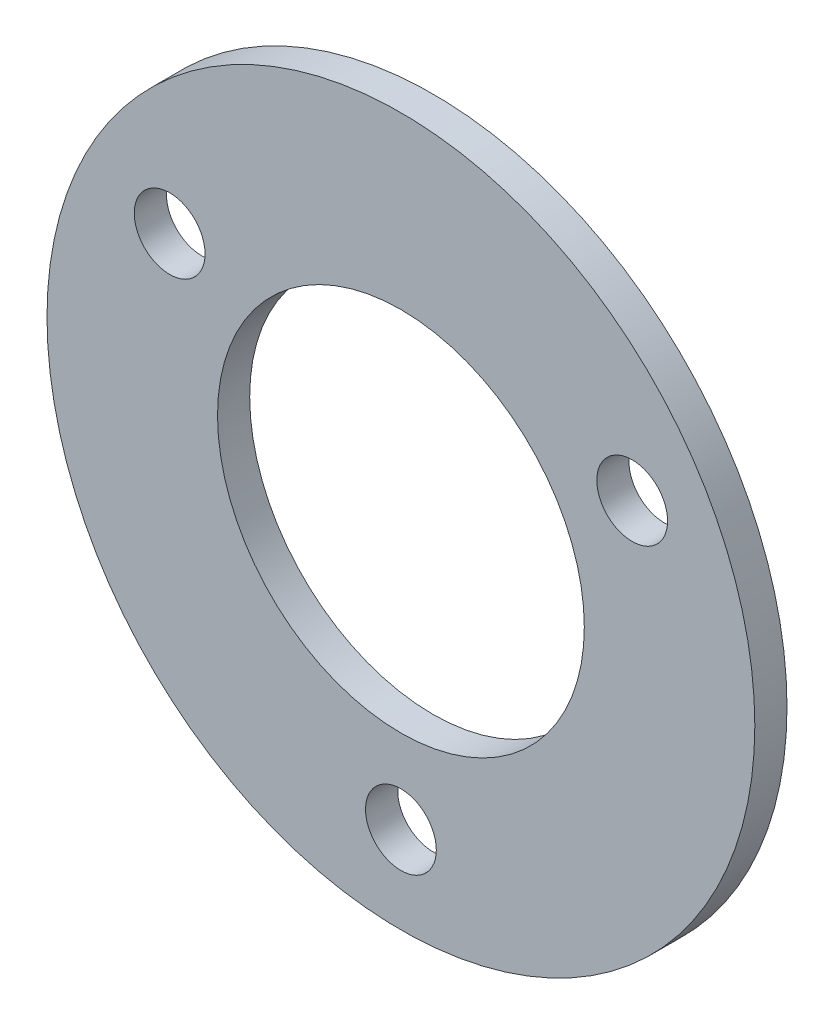
from build123d import *

# Parameters (mm, degrees)
SKETCH1_R            = 11
SKETCH1_R_2          = 5.7
SKETCH1_R_3          = 1.1
OUTER_RACE_CAP_DEPTH = 1


with BuildPart() as part:
    # Sketch1 → Outer_Race_Cap (new body)
    with BuildSketch(Plane.XY):
        Circle(SKETCH1_R)
        Circle(SKETCH1_R_2, mode=Mode.SUBTRACT)
        with Locations((7.188010851, 4.15)):
            Circle(SKETCH1_R_3, mode=Mode.SUBTRACT)
        with Locations((-7.188010851, 4.15)):
            Circle(SKETCH1_R_3, mode=Mode.SUBTRACT)
        with Locations((0, -8.3)):
            Circle(SKETCH1_R_3, mode=Mode.SUBTRACT)
    extrude(amount=OUTER_RACE_CAP_DEPTH)


solid = part.part
